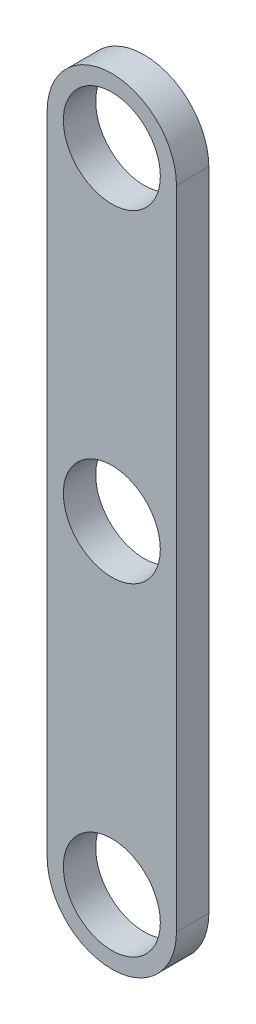
from build123d import *

# Parameters (mm, degrees)
SKETCH2_R           = 7.5
BOSS_EXTRUDE1_DEPTH = 5


with BuildPart() as part:
    # Sketch2 → Boss-Extrude1 (new body)
    with BuildSketch(Plane.XY):
        with BuildLine():
            Line((-10, 0), (-10, 100))
            ThreePointArc((-10, 100), (0, 110), (10, 100))
            Line((10, 100), (10, 0))
            ThreePointArc((10, 0), (0, -10), (-10, 0))
        make_face()
        with Locations((0, 100)):
            Circle(SKETCH2_R, mode=Mode.SUBTRACT)
        Circle(SKETCH2_R, mode=Mode.SUBTRACT)
        with Locations((0, 50)):
            Circle(SKETCH2_R, mode=Mode.SUBTRACT)
    extrude(amount=BOSS_EXTRUDE1_DEPTH)


solid = part.part
